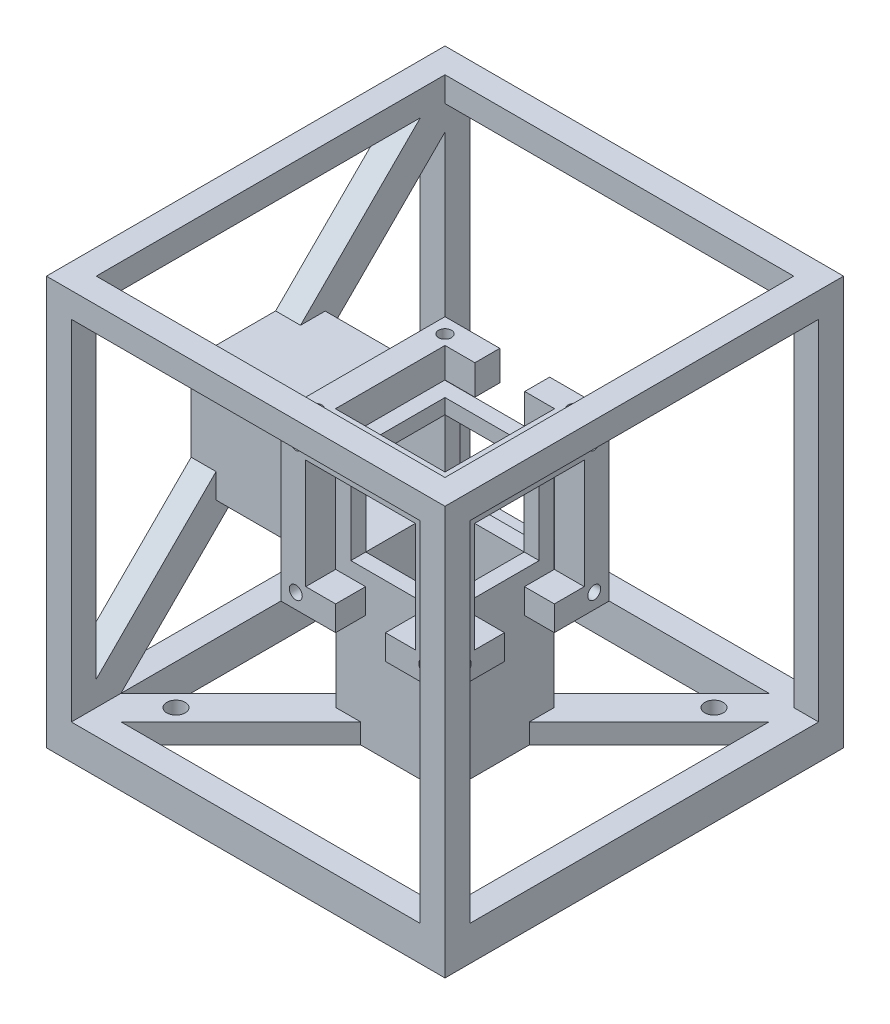
from build123d import *

# Parameters (mm, degrees)
SKETCH_1_W                      = 80
SKETCH_1_H                      = 80
SKETCH_1_R                      = 1.85
EXTRUDE_1_DEPTH                 = 7
SKETCH_6_R                      = 1.85
CUT_EXTRUDE_1_DEPTH             = 3
SKETCH_4_W                      = 5
SKETCH_4_H                      = 5
EXTRUDE_2_DEPTH                 = 70
SKETCH_5_W                      = 80
SKETCH_5_H                      = 80
SKETCH_5_W_2                    = 70
SKETCH_5_H_2                    = 70
EXTRUDE_3_DEPTH                 = 5
EXTRUDE_5_DEPTH                 = 5
SKETCH_11_W                     = 21.899494936
SKETCH_11_H                     = 21.899494936
EXTRUDE_6_DEPTH                 = 45.949747468
SKETCH_12_W                     = 21.899494936
SKETCH_12_H                     = 21.899494936
EXTRUDE_7_DEPTH                 = 45.949747468
SKETCH_16_W                     = 32
SKETCH_16_H                     = 32
SKETCH_16_W_2                   = 22
SKETCH_16_H_2                   = 22
EXTRUDE_9_DEPTH                 = 6
SKETCH_18_W                     = 32
SKETCH_18_H                     = 32
SKETCH_18_W_2                   = 22
SKETCH_18_H_2                   = 22
EXTRUDE_10_DEPTH                = 6
SKETCH_19_W                     = 32
SKETCH_19_H                     = 32
SKETCH_19_W_2                   = 22
SKETCH_19_H_2                   = 22
EXTRUDE_11_DEPTH                = 6
CUT_EXTRUDE_2_DEPTH             = 2
CUT_EXTRUDE_2_DEPTH_BACK        = 6
SKETCH_20_R                     = 1.3
SKETCH_20_W                     = 10
SKETCH_20_H                     = 5
CUT_EXTRUDE_3_REACH             = 129.935
SKETCH_21_R                     = 1.3
SKETCH_21_W                     = 10
SKETCH_21_H                     = 5
CUT_EXTRUDE_3_DIRECTION_2_DEPTH = 2
CUT_EXTRUDE_4_REACH             = 129.574
SKETCH_23_R                     = 1.3
SKETCH_23_W                     = 10
SKETCH_23_H                     = 5
CUT_EXTRUDE_4_DIRECTION_2_DEPTH = 2
SKETCH_25_W                     = 15.899494936
SKETCH_25_H                     = 15.899494936
CUT_EXTRUDE_5_DEPTH             = 50.949747468
CUT_EXTRUDE_6_REACH             = 139.989
SKETCH_26_W                     = 15.899494936
SKETCH_26_H                     = 15.899494936
SKETCH_27_W                     = 15.899494936
SKETCH_27_H                     = 15.899494936
CUT_EXTRUDE_7_DEPTH             = 21.899494937


with BuildPart() as part:
    # 草图1 → 凸台-拉伸1 (new body)
    with BuildSketch(Plane(origin=(0, 0, 0), x_dir=(1, 0, 0), z_dir=(0, 1, 0))):
        with Locations((40, 40)):
            Rectangle(SKETCH_1_W, SKETCH_1_H)
        with Locations(Location((13, 13, 0), (0, 0, 270))):
            Circle(SKETCH_1_R, mode=Mode.SUBTRACT)
        with Locations(Location((67, 13, 0), (0, 0, 90))):
            Circle(SKETCH_1_R, mode=Mode.SUBTRACT)
        with Locations(Location((67, 67, 0), (0, 0, 270))):
            Circle(SKETCH_1_R, mode=Mode.SUBTRACT)
        with Locations(Location((13, 67, 0), (0, 0, 90))):
            Circle(SKETCH_1_R, mode=Mode.SUBTRACT)
        Polygon((5, 9.949747468), (29.050252532, 34), (29.050252532, 46), (5, 70.050252532), align=None, mode=Mode.SUBTRACT)
        Polygon((9.949747468, 5), (34, 29.050252532), (46, 29.050252532), (70.050252532, 5), align=None, mode=Mode.SUBTRACT)
        Polygon((9.949747468, 75), (34, 50.949747468), (46, 50.949747468), (70.050252532, 75), align=None, mode=Mode.SUBTRACT)
        Polygon((75, 9.949747468), (75, 70.050252532), (50.949747468, 46), (50.949747468, 34), align=None, mode=Mode.SUBTRACT)
    extrude(amount=EXTRUDE_1_DEPTH)

    # 草图6 → 切除-拉伸1 (cut)
    with BuildSketch(Plane.XZ):
        Polygon((9.949747468, -5), (5, -5), (5, -9.949747468), (5, -70.050252532), (5, -75), (9.949747468, -75), (70.050252532, -75), (75, -75), (75, -70.050252532), (75, -9.949747468), (75, -5), (70.050252532, -5), align=None)
        with Locations(Location((13, -67, 0), (0, 0, 270))):
            Circle(SKETCH_6_R, mode=Mode.SUBTRACT)
        with Locations(Location((67, -67, 0), (0, 0, 270))):
            Circle(SKETCH_6_R, mode=Mode.SUBTRACT)
        with Locations(Location((13, -13, 0), (0, 0, 270))):
            Circle(SKETCH_6_R, mode=Mode.SUBTRACT)
        with Locations(Location((67, -13, 0), (0, 0, 270))):
            Circle(SKETCH_6_R, mode=Mode.SUBTRACT)
    extrude(amount=-CUT_EXTRUDE_1_DEPTH, mode=Mode.SUBTRACT)

    # 草图4 → 凸台-拉伸2 (add)
    with BuildSketch(Plane(origin=(0, 7, 0), x_dir=(1, 0, 0), z_dir=(0, 1, 0))):
        with Locations((2.5, 2.5)):
            Rectangle(SKETCH_4_W, SKETCH_4_H)
        with Locations((77.5, 2.5)):
            Rectangle(SKETCH_4_W, SKETCH_4_H)
        with Locations((77.5, 77.5)):
            Rectangle(SKETCH_4_W, SKETCH_4_H)
        with Locations((2.5, 77.5)):
            Rectangle(SKETCH_4_W, SKETCH_4_H)
    extrude(amount=EXTRUDE_2_DEPTH)

    # 草图5 → 凸台-拉伸3 (add)
    with BuildSketch(Plane(origin=(0, 77, 0), x_dir=(1, 0, 0), z_dir=(0, 1, 0))):
        with Locations((40, 40)):
            Rectangle(SKETCH_5_W, SKETCH_5_H)
        with Locations((40, 40)):
            Rectangle(SKETCH_5_W_2, SKETCH_5_H_2, mode=Mode.SUBTRACT)
    extrude(amount=EXTRUDE_3_DEPTH)

    # 草图7 → 凸台-拉伸5 (add)
    with BuildSketch(Plane(origin=(5, 0, 0), x_dir=(0, 0, -1), z_dir=(1, 0, 0))):
        Polygon((29.050252532, 48), (29.050252532, 36), (5, 11.949747468), (5, 7), (9.949747468, 7), (34, 31.050252532), (46, 31.050252532), (70.050252532, 7), (75, 7), (75, 11.949747468), (50.949747468, 36), (50.949747468, 48), (75, 72.050252532), (75, 77), (70.050252532, 77), (46, 52.949747468), (34, 52.949747468), (9.949747468, 77), (5, 77), (5, 72.050252532), align=None)
    extrude(amount=-EXTRUDE_5_DEPTH)

    # 草图11 → 凸台-拉伸6 (add)
    with BuildSketch(Plane(origin=(5, 0, 0), x_dir=(0, 0, -1), z_dir=(1, 0, 0))):
        with Locations((40, 42)):
            Rectangle(SKETCH_11_W, SKETCH_11_H)
    extrude(amount=EXTRUDE_6_DEPTH)

    # 草图12 → 凸台-拉伸7 (add)
    with BuildSketch(Plane(origin=(0, 7, 0), x_dir=(1, 0, 0), z_dir=(0, 1, 0))):
        with Locations((40, 40)):
            Rectangle(SKETCH_12_W, SKETCH_12_H)
    extrude(amount=EXTRUDE_7_DEPTH)

    # 草图16 → 凸台-拉伸9 (add)
    with BuildSketch(Plane.XY.offset(-29.050252532)):
        with Locations((40, 42)):
            Rectangle(SKETCH_16_W, SKETCH_16_H)
        with Locations((40, 42)):
            Rectangle(SKETCH_16_W_2, SKETCH_16_H_2, mode=Mode.SUBTRACT)
    extrude(amount=EXTRUDE_9_DEPTH)

    # 草图18 → 凸台-拉伸10 (add)
    with BuildSketch(Plane(origin=(50.949747468, 0, 0), x_dir=(0, 0, -1), z_dir=(1, 0, 0))):
        with Locations((40, 42)):
            Rectangle(SKETCH_18_W, SKETCH_18_H)
        with Locations((40, 42)):
            Rectangle(SKETCH_18_W_2, SKETCH_18_H_2, mode=Mode.SUBTRACT)
    extrude(amount=EXTRUDE_10_DEPTH)

    # 草图19 → 凸台-拉伸11 (add)
    with BuildSketch(Plane(origin=(0, 52.949747468, 0), x_dir=(1, 0, 0), z_dir=(0, 1, 0))):
        with Locations((40, 40)):
            Rectangle(SKETCH_19_W, SKETCH_19_H)
        with Locations((40, 40)):
            Rectangle(SKETCH_19_W_2, SKETCH_19_H_2, mode=Mode.SUBTRACT)
    extrude(amount=EXTRUDE_11_DEPTH)

    # 草图20 → 切除-拉伸2 (cut, two sides: drawn at the far end of the back side and taken through both)
    with BuildSketch(Plane.XY.offset(-23.050252532).offset(-CUT_EXTRUDE_2_DEPTH_BACK)):
        with Locations((53, 29)):
            Circle(SKETCH_20_R)
        with Locations((27, 29)):
            Circle(SKETCH_20_R)
        with Locations((53, 55)):
            Circle(SKETCH_20_R)
        with Locations((27, 55)):
            Circle(SKETCH_20_R)
        with Locations((40, 28.5)):
            Rectangle(SKETCH_20_W, SKETCH_20_H)
    extrude(amount=CUT_EXTRUDE_2_DEPTH + CUT_EXTRUDE_2_DEPTH_BACK, mode=Mode.SUBTRACT)

    # 切除-拉伸3: up to this face of the body (flat: up to its plane)
    cut_extrude_3_end = Plane(part.part.faces().sort_by_distance((50.949747468, 39.454447246, -53.495300223))[0])
    # 草图21 → 切除-拉伸3 (cut, up to the picked face)
    with BuildSketch(Plane(origin=(56.949747468, 0, 0), x_dir=(0, 0, -1), z_dir=(1, 0, 0)), mode=Mode.PRIVATE) as cut_extrude_3_sk1:
        with Locations((53, 29)):
            Circle(SKETCH_21_R)
    cut_extrude_3_tool1 = split(extrude(cut_extrude_3_sk1.sketch, amount=-CUT_EXTRUDE_3_REACH, mode=Mode.PRIVATE), bisect_by=cut_extrude_3_end, keep=Keep.BOTH, mode=Mode.PRIVATE)
    # 草图21 → 切除-拉伸3 (cut, up to the picked face)
    with BuildSketch(Plane(origin=(56.949747468, 0, 0), x_dir=(0, 0, -1), z_dir=(1, 0, 0)), mode=Mode.PRIVATE) as cut_extrude_3_sk2:
        with Locations(Location((27, 29, 0), (0, 0, 90))):
            Circle(SKETCH_21_R)
    cut_extrude_3_tool2 = split(extrude(cut_extrude_3_sk2.sketch, amount=-CUT_EXTRUDE_3_REACH, mode=Mode.PRIVATE), bisect_by=cut_extrude_3_end, keep=Keep.BOTH, mode=Mode.PRIVATE)
    # 草图21 → 切除-拉伸3 (cut, up to the picked face)
    with BuildSketch(Plane(origin=(56.949747468, 0, 0), x_dir=(0, 0, -1), z_dir=(1, 0, 0)), mode=Mode.PRIVATE) as cut_extrude_3_sk3:
        with Locations(Location((27, 55, 0), (0, 0, 90))):
            Circle(SKETCH_21_R)
    cut_extrude_3_tool3 = split(extrude(cut_extrude_3_sk3.sketch, amount=-CUT_EXTRUDE_3_REACH, mode=Mode.PRIVATE), bisect_by=cut_extrude_3_end, keep=Keep.BOTH, mode=Mode.PRIVATE)
    # 草图21 → 切除-拉伸3 (cut, up to the picked face)
    with BuildSketch(Plane(origin=(56.949747468, 0, 0), x_dir=(0, 0, -1), z_dir=(1, 0, 0)), mode=Mode.PRIVATE) as cut_extrude_3_sk4:
        with Locations((53, 55)):
            Circle(SKETCH_21_R)
    cut_extrude_3_tool4 = split(extrude(cut_extrude_3_sk4.sketch, amount=-CUT_EXTRUDE_3_REACH, mode=Mode.PRIVATE), bisect_by=cut_extrude_3_end, keep=Keep.BOTH, mode=Mode.PRIVATE)
    # 草图21 → 切除-拉伸3 (cut, up to the picked face)
    with BuildSketch(Plane(origin=(56.949747468, 0, 0), x_dir=(0, 0, -1), z_dir=(1, 0, 0)), mode=Mode.PRIVATE) as cut_extrude_3_sk5:
        with Locations((40, 28.5)):
            Rectangle(SKETCH_21_W, SKETCH_21_H)
    cut_extrude_3_tool5 = split(extrude(cut_extrude_3_sk5.sketch, amount=-CUT_EXTRUDE_3_REACH, mode=Mode.PRIVATE), bisect_by=cut_extrude_3_end, keep=Keep.BOTH, mode=Mode.PRIVATE)
    add(cut_extrude_3_tool1.solids().sort_by(Axis((56.949747, 29, -53), (-1, 0, 0)))[0], mode=Mode.SUBTRACT)
    add(cut_extrude_3_tool2.solids().sort_by(Axis((56.949747, 29, -27), (-1, 0, 0)))[0], mode=Mode.SUBTRACT)
    add(cut_extrude_3_tool3.solids().sort_by(Axis((56.949747, 55, -27), (-1, 0, 0)))[0], mode=Mode.SUBTRACT)
    add(cut_extrude_3_tool4.solids().sort_by(Axis((56.949747, 55, -53), (-1, 0, 0)))[0], mode=Mode.SUBTRACT)
    add(cut_extrude_3_tool5.solids().sort_by(Axis((56.949747, 28.5, -40), (-1, 0, 0)))[0], mode=Mode.SUBTRACT)

    # 草图21 → 切除-拉伸3 direction 2 (cut)
    with BuildSketch(Plane(origin=(56.949747468, 0, 0), x_dir=(0, 0, -1), z_dir=(1, 0, 0))):
        with Locations((53, 29)):
            Circle(SKETCH_21_R)
        with Locations(Location((27, 29, 0), (0, 0, 90))):
            Circle(SKETCH_21_R)
        with Locations(Location((27, 55, 0), (0, 0, 90))):
            Circle(SKETCH_21_R)
        with Locations((53, 55)):
            Circle(SKETCH_21_R)
        with Locations((40, 28.5)):
            Rectangle(SKETCH_21_W, SKETCH_21_H)
    extrude(amount=CUT_EXTRUDE_3_DIRECTION_2_DEPTH, mode=Mode.SUBTRACT)

    # 切除-拉伸4: up to this face of the body (flat: up to its plane)
    cut_extrude_4_end = Plane(part.part.faces().sort_by_distance((37.454447246, 52.949747468, -53.495300223))[0])
    # 草图23 → 切除-拉伸4 (cut, up to the picked face)
    with BuildSketch(Plane(origin=(0, 58.949747468, 0), x_dir=(1, 0, 0), z_dir=(0, 1, 0)), mode=Mode.PRIVATE) as cut_extrude_4_sk1:
        with Locations(Location((27, 53, 0), (0, 0, 270))):
            Circle(SKETCH_23_R)
    cut_extrude_4_tool1 = split(extrude(cut_extrude_4_sk1.sketch, amount=-CUT_EXTRUDE_4_REACH, mode=Mode.PRIVATE), bisect_by=cut_extrude_4_end, keep=Keep.BOTH, mode=Mode.PRIVATE)
    # 草图23 → 切除-拉伸4 (cut, up to the picked face)
    with BuildSketch(Plane(origin=(0, 58.949747468, 0), x_dir=(1, 0, 0), z_dir=(0, 1, 0)), mode=Mode.PRIVATE) as cut_extrude_4_sk2:
        with Locations(Location((53, 53, 0), (0, 0, 270))):
            Circle(SKETCH_23_R)
    cut_extrude_4_tool2 = split(extrude(cut_extrude_4_sk2.sketch, amount=-CUT_EXTRUDE_4_REACH, mode=Mode.PRIVATE), bisect_by=cut_extrude_4_end, keep=Keep.BOTH, mode=Mode.PRIVATE)
    # 草图23 → 切除-拉伸4 (cut, up to the picked face)
    with BuildSketch(Plane(origin=(0, 58.949747468, 0), x_dir=(1, 0, 0), z_dir=(0, 1, 0)), mode=Mode.PRIVATE) as cut_extrude_4_sk3:
        with Locations(Location((53, 27, 0), (0, 0, 135))):
            Circle(SKETCH_23_R)
    cut_extrude_4_tool3 = split(extrude(cut_extrude_4_sk3.sketch, amount=-CUT_EXTRUDE_4_REACH, mode=Mode.PRIVATE), bisect_by=cut_extrude_4_end, keep=Keep.BOTH, mode=Mode.PRIVATE)
    # 草图23 → 切除-拉伸4 (cut, up to the picked face)
    with BuildSketch(Plane(origin=(0, 58.949747468, 0), x_dir=(1, 0, 0), z_dir=(0, 1, 0)), mode=Mode.PRIVATE) as cut_extrude_4_sk4:
        with Locations(Location((27, 27, 0), (0, 0, 180))):
            Circle(SKETCH_23_R)
    cut_extrude_4_tool4 = split(extrude(cut_extrude_4_sk4.sketch, amount=-CUT_EXTRUDE_4_REACH, mode=Mode.PRIVATE), bisect_by=cut_extrude_4_end, keep=Keep.BOTH, mode=Mode.PRIVATE)
    # 草图23 → 切除-拉伸4 (cut, up to the picked face)
    with BuildSketch(Plane(origin=(0, 58.949747468, 0), x_dir=(1, 0, 0), z_dir=(0, 1, 0)), mode=Mode.PRIVATE) as cut_extrude_4_sk5:
        with Locations((40, 53.5)):
            Rectangle(SKETCH_23_W, SKETCH_23_H)
    cut_extrude_4_tool5 = split(extrude(cut_extrude_4_sk5.sketch, amount=-CUT_EXTRUDE_4_REACH, mode=Mode.PRIVATE), bisect_by=cut_extrude_4_end, keep=Keep.BOTH, mode=Mode.PRIVATE)
    add(cut_extrude_4_tool1.solids().sort_by(Axis((27, 58.949747, -53), (0, -1, 0)))[0], mode=Mode.SUBTRACT)
    add(cut_extrude_4_tool2.solids().sort_by(Axis((53, 58.949747, -53), (0, -1, 0)))[0], mode=Mode.SUBTRACT)
    add(cut_extrude_4_tool3.solids().sort_by(Axis((53, 58.949747, -27), (0, -1, 0)))[0], mode=Mode.SUBTRACT)
    add(cut_extrude_4_tool4.solids().sort_by(Axis((27, 58.949747, -27), (0, -1, 0)))[0], mode=Mode.SUBTRACT)
    add(cut_extrude_4_tool5.solids().sort_by(Axis((40, 58.949747, -53.5), (0, -1, 0)))[0], mode=Mode.SUBTRACT)

    # 草图23 → 切除-拉伸4 direction 2 (cut)
    with BuildSketch(Plane(origin=(0, 58.949747468, 0), x_dir=(1, 0, 0), z_dir=(0, 1, 0))):
        with Locations(Location((27, 53, 0), (0, 0, 270))):
            Circle(SKETCH_23_R)
        with Locations(Location((53, 53, 0), (0, 0, 270))):
            Circle(SKETCH_23_R)
        with Locations(Location((53, 27, 0), (0, 0, 135))):
            Circle(SKETCH_23_R)
        with Locations(Location((27, 27, 0), (0, 0, 180))):
            Circle(SKETCH_23_R)
        with Locations((40, 53.5)):
            Rectangle(SKETCH_23_W, SKETCH_23_H)
    extrude(amount=CUT_EXTRUDE_4_DIRECTION_2_DEPTH, mode=Mode.SUBTRACT)

    # 草图25 → 切除-拉伸5 (cut)
    with BuildSketch(Plane.ZY):
        with Locations((-40, 42)):
            Rectangle(SKETCH_25_W, SKETCH_25_H)
    extrude(amount=-CUT_EXTRUDE_5_DEPTH, mode=Mode.SUBTRACT)

    # 切除-拉伸6: up to this face of the body (flat: up to its plane)
    cut_extrude_6_end = Plane(part.part.faces().sort_by_distance((39.974873734, 52.949747468, -40))[0])
    # 草图26 → 切除-拉伸6 (cut, up to the picked face)
    with BuildSketch(Plane.XZ.offset(-3), mode=Mode.PRIVATE) as cut_extrude_6_sk1:
        with Locations((40, -40)):
            Rectangle(SKETCH_26_W, SKETCH_26_H)
    cut_extrude_6_tool1 = split(extrude(cut_extrude_6_sk1.sketch, amount=-CUT_EXTRUDE_6_REACH, mode=Mode.PRIVATE), bisect_by=cut_extrude_6_end, keep=Keep.BOTH, mode=Mode.PRIVATE)
    add(cut_extrude_6_tool1.solids().sort_by(Axis((40, 3, -40), (0, 1, 0)))[0], mode=Mode.SUBTRACT)

    # 草图27 → 切除-拉伸7 (cut)
    with BuildSketch(Plane.XY.offset(-29.050252532)):
        with Locations((40, 42)):
            Rectangle(SKETCH_27_W, SKETCH_27_H)
    extrude(amount=-CUT_EXTRUDE_7_DEPTH, mode=Mode.SUBTRACT)


solid = part.part
